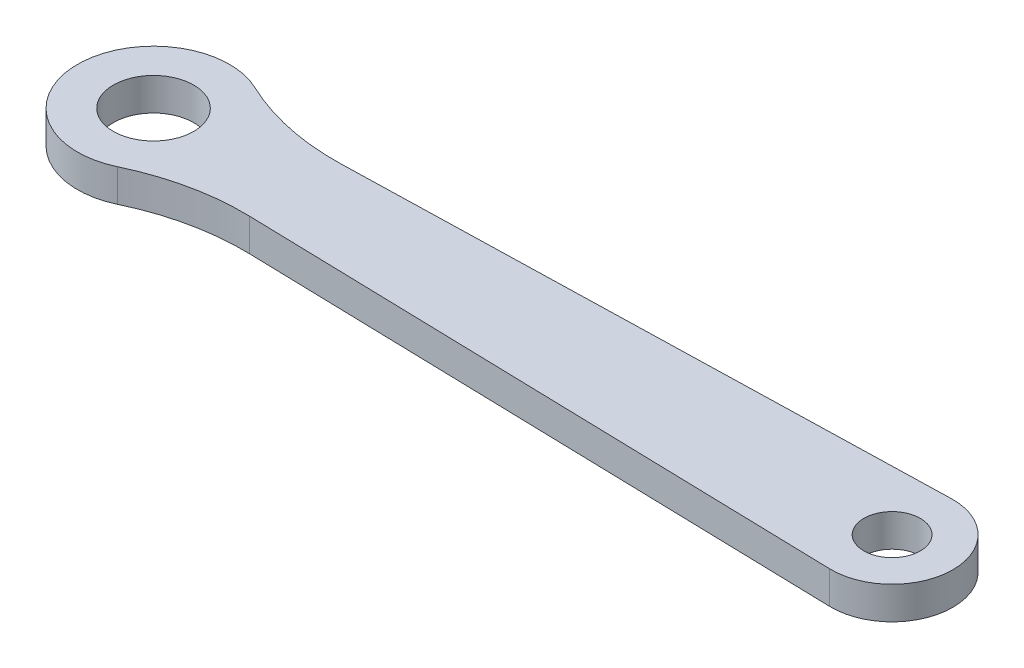
from build123d import *

# Parameters (mm, degrees)
SKETCH_1_R      = 18.5
SKETCH_1_R_2    = 13
EXTRUDE_1_DEPTH = 15


with BuildPart() as part:
    # 草图1 → 凸台-拉伸1 (new body)
    with BuildSketch(Plane(origin=(0, 0, 0), x_dir=(1, 0, 0), z_dir=(0, 1, 0))):
        with BuildLine():
            Line((65.196415688, 20.938478113), (339.27978891, 27.990735896))
            ThreePointArc((339.27978891, 27.990735896), (368, 0), (339.27978891, -27.990735896))
            Line((339.27978891, -27.990735896), (65.196415688, -20.938478113))
            ThreePointArc((65.196415688, -20.938478113), (39.495702891, -23.306065445), (15.054107063, -31.597054618))
            ThreePointArc((15.054107063, -31.597054618), (-35, 0), (15.054107063, 31.597054618))
            ThreePointArc((15.054107063, 31.597054618), (39.495702891, 23.306065445), (65.196415688, 20.938478113))
        make_face()
        with Locations(Location((0, 0, 0), (0, 0, 270))):
            Circle(SKETCH_1_R, mode=Mode.SUBTRACT)
        with Locations(Location((340, 0, 0), (0, 0, 270))):
            Circle(SKETCH_1_R_2, mode=Mode.SUBTRACT)
    extrude(amount=EXTRUDE_1_DEPTH)


solid = part.part
